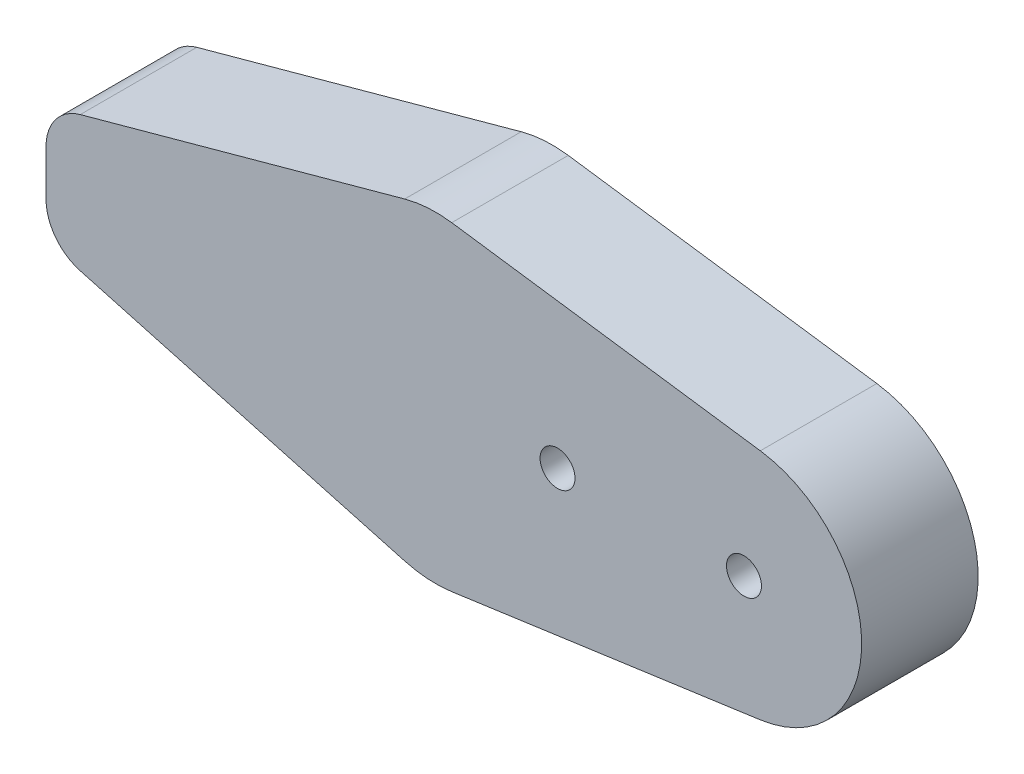
from build123d import *

# Parameters (mm, degrees)
BOSS_EXTRUDE1_DEPTH = 5
CUT_EXTRUDE2_DEPTH  = 16
SKETCH3_R           = 0.75
CUT_EXTRUDE3_DEPTH  = 8


with BuildPart() as part:
    # Sketch1 → Boss-Extrude1 (new body)
    with BuildSketch(Plane.XY):
        with BuildLine():
            Line((-11.358992197, -0.975163345), (-11.358992197, 0.975163345))
            ThreePointArc((-11.358992197, 0.975163345), (-10.949461796, 2.187766517), (-9.888585744, 2.903771827))
            Line((-9.888585744, 2.903771827), (4.032865761, 6.726585506))
            ThreePointArc((4.032865761, 6.726585506), (5.035336984, 6.894716557), (6.051095895, 6.856631946))
            Line((6.051095895, 6.856631946), (19.293138558, 5))
            ThreePointArc((19.293138558, 5), (23.641007803, 0), (19.293138558, -5))
            Line((19.293138558, -5), (6.051095895, -6.856631946))
            ThreePointArc((6.051095895, -6.856631946), (5.035336984, -6.894716557), (4.032865761, -6.726585506))
            Line((4.032865761, -6.726585506), (-9.888585744, -2.903771827))
            ThreePointArc((-9.888585744, -2.903771827), (-10.949461796, -2.187766517), (-11.358992197, -0.975163345))
        make_face()
    extrude(amount=BOSS_EXTRUDE1_DEPTH)

    # Sketch2 → Cut-Extrude2 (cut)
    with BuildSketch(Plane.ZY.offset(11.358992197)):
        with BuildLine():
            Line((1, -0.745034354), (1, 0.754965646))
            Line((1, 0.754965646), (3, 0.754965646))
            ThreePointArc((3, 0.754965646), (3.75, 0.004965646), (3, -0.745034354))
            Line((3, -0.745034354), (1, -0.745034354))
        make_face()
    extrude(amount=-CUT_EXTRUDE2_DEPTH, mode=Mode.SUBTRACT)

    # Sketch3 → Cut-Extrude3 (cut)
    with BuildSketch(Plane.XY.offset(5)):
        with Locations((18.592101719, 0)):
            Circle(SKETCH3_R)
        with Locations((10.592101719, 0)):
            Circle(SKETCH3_R)
    extrude(amount=-CUT_EXTRUDE3_DEPTH, mode=Mode.SUBTRACT)


solid = part.part
